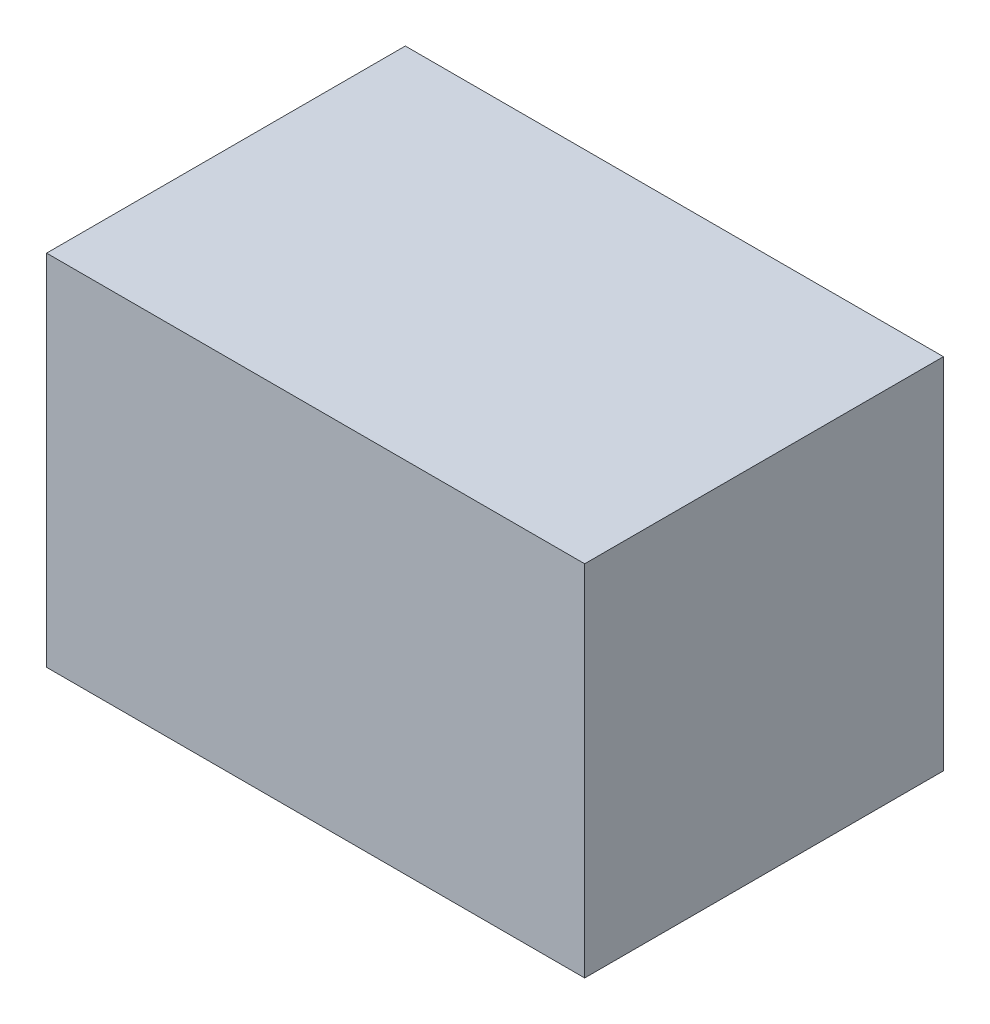
from build123d import *

# Parameters (mm, degrees)
SKETCH1_W           = 60
SKETCH1_H           = 40
BOSS_EXTRUDE1_DEPTH = 40


with BuildPart() as part:
    # Sketch1 → Boss-Extrude1 (new body)
    with BuildSketch(Plane(origin=(0, 0, 0), x_dir=(1, 0, 0), z_dir=(0, 1, 0))):
        with Locations((30, 20)):
            Rectangle(SKETCH1_W, SKETCH1_H)
    extrude(amount=BOSS_EXTRUDE1_DEPTH)


solid = part.part
